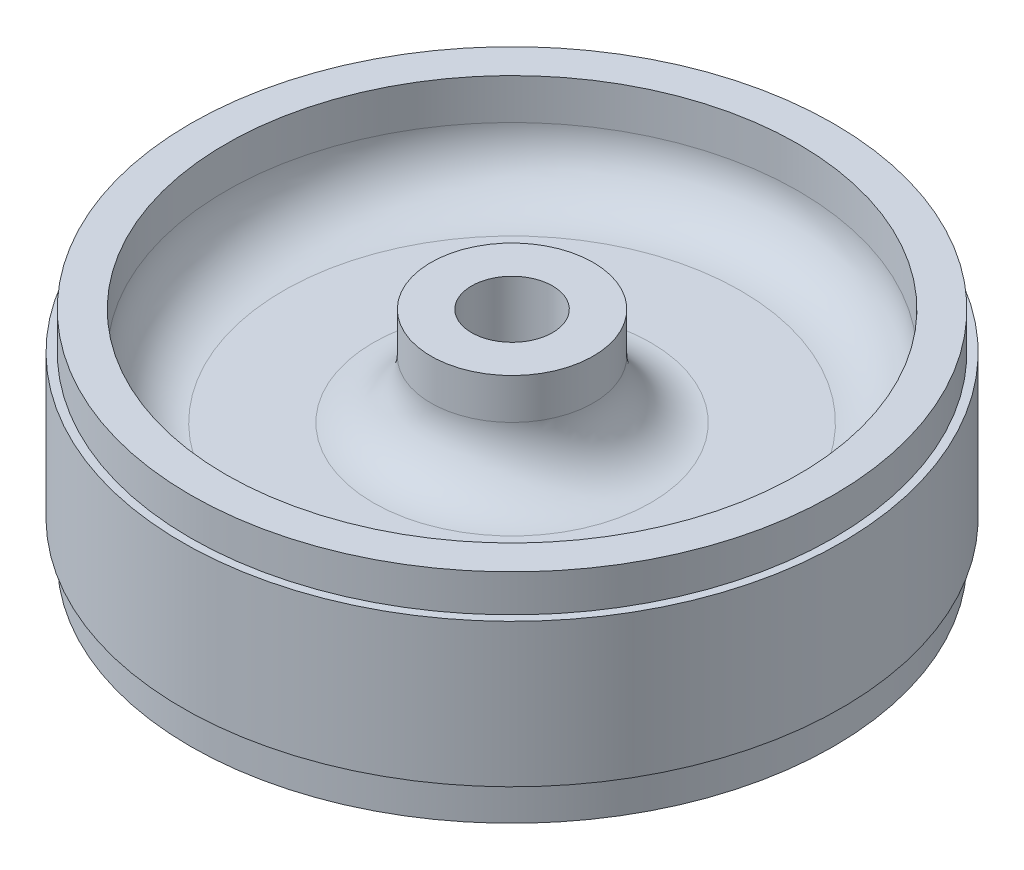
from build123d import *


with BuildPart() as part:
    # Sketch1 → Revolve1 (revolve)
    with BuildSketch(Plane.XY, mode=Mode.PRIVATE) as revolve1_sk:
        with BuildLine():
            Line((-9.740947322, 26.185345129), (-9.740947322, -26.185345129))
            Line((-9.740947322, -26.185345129), (-19.522320179, -26.185345129))
            Line((-19.522320179, -26.185345129), (-19.522320179, -16.409199987))
            ThreePointArc((-19.522320179, -16.409199987), (-23.579011192, -6.615481526), (-33.372729652, -2.558790514))
            Line((-33.372729652, -2.558790514), (-55.000709219, -2.558790514))
            ThreePointArc((-55.000709219, -2.558790514), (-64.79442768, -6.615481526), (-68.851118692, -16.409199987))
            Line((-68.851118692, -16.409199987), (-68.851118692, -26.185345129))
            Line((-68.851118692, -26.185345129), (-77.3516349, -26.185345129))
            Line((-77.3516349, -26.185345129), (-77.3516349, -17.373618967))
            Line((-77.3516349, -17.373618967), (-77.3516349, -17.233064019))
            Line((-77.3516349, -17.233064019), (-79.265002978, -17.233064019))
            Line((-79.265002978, -17.233064019), (-79.265002978, 17.233064019))
            Line((-79.265002978, 17.233064019), (-77.3516349, 17.233064019))
            Line((-77.3516349, 17.233064019), (-77.3516349, 17.373618967))
            Line((-77.3516349, 17.373618967), (-77.3516349, 26.185345129))
            Line((-77.3516349, 26.185345129), (-68.851118692, 26.185345129))
            Line((-68.851118692, 26.185345129), (-68.851118692, 16.409199987))
            ThreePointArc((-68.851118692, 16.409199987), (-64.79442768, 6.615481526), (-55.000709219, 2.558790514))
            Line((-55.000709219, 2.558790514), (-33.372729652, 2.558790514))
            ThreePointArc((-33.372729652, 2.558790514), (-23.579011192, 6.615481526), (-19.522320179, 16.409199987))
            Line((-19.522320179, 16.409199987), (-19.522320179, 26.185345129))
            Line((-19.522320179, 26.185345129), (-9.740947322, 26.185345129))
        make_face()
    revolve(revolve1_sk.sketch.rotate(Axis((0, 0, 0), (0, 1, 0)), 270), axis=Axis((0, 0, 0), (0, 1, 0)))


solid = part.part
